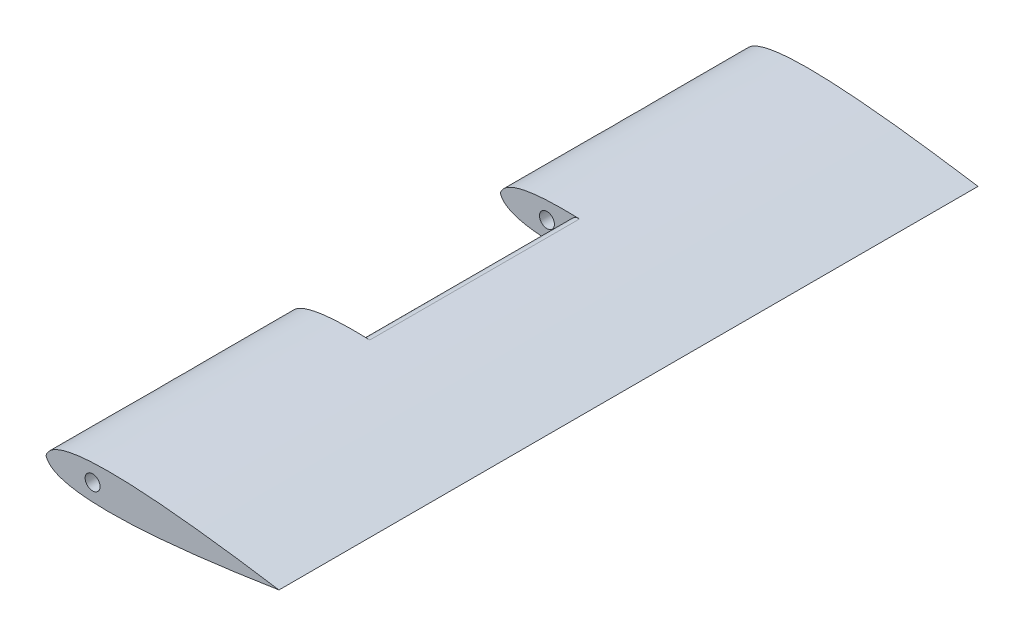
from build123d import *

# Parameters (mm, degrees)
BOSS_EXTRUDE1_DEPTH      = 75
BOSS_EXTRUDE1_DEPTH_BACK = 75
SKETCH3_R                = 1.6
SKETCH1_W                = 15
SKETCH1_H                = 45
FILLET1_R                = 2


with BuildPart() as part:
    # Sketch3 → Boss-Extrude1 (new, two sides: drawn at the far end of the back side and taken through both)
    with BuildSketch(Plane.XY.offset(-BOSS_EXTRUDE1_DEPTH_BACK)):
        with BuildLine():
            add(Edge.make_bspline(
                [(-96.388888889, 0), (-94.217851925, -7.513577122), (-46.388888889, 0)],
                knots=[0, 0, 0, 1, 1, 1], degree=2))
            add(Edge.make_bspline(
                [(-96.388888889, 0), (-94.217851925, 7.513577122), (-46.388888889, 0)],
                knots=[0, 0, 0, 1, 1, 1], degree=2))
        make_face()
        with Locations((-86.388888889, 0)):
            Circle(SKETCH3_R, mode=Mode.SUBTRACT)
    extrude(amount=BOSS_EXTRUDE1_DEPTH + BOSS_EXTRUDE1_DEPTH_BACK)

    # Sketch1 → Cut-Revolve1 (revolve, cut)
    with BuildSketch(Plane(origin=(0, 0, 0), x_dir=(1, 0, 0), z_dir=(0, 1, 0))):
        with Locations((-88.888888889, 0)):
            Rectangle(SKETCH1_W, SKETCH1_H)
    revolve(axis=Axis((-96.388888889, 0, -75), (0, 0, 1)), mode=Mode.SUBTRACT)

    # Fillet1
    fillet1_edges = [part.edges().sort_by_distance(p)[0] for p in [
        (-81.86563433, -3.751676562, -11.2499997),
        (-81.86563433, 3.751676562, 11.25),
    ]]
    fillet(fillet1_edges, radius=FILLET1_R)


solid = part.part
